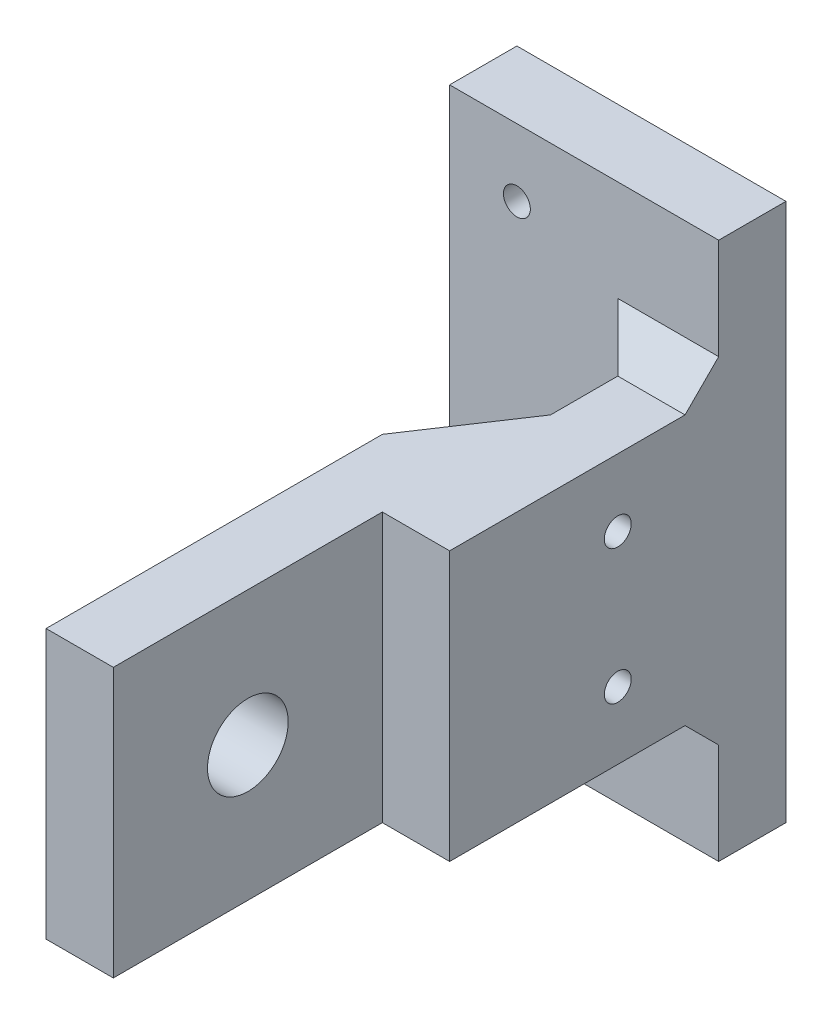
from build123d import *

# Parameters (mm, degrees)
SKETCH1_W                      = 80
SKETCH1_H                      = 80
BOSS_EXTRUDE1_DEPTH            = 10
SKETCH2_W                      = 40
SKETCH2_H                      = 40
BOSS_EXTRUDE2_DEPTH            = 80
F_4_0_4_DIAMETER_HOLE1_D       = 4
CUT_EXTRUDE1_REACH             = 117.326
CUT_EXTRUDE1_DIRECTION_2_REACH = 117.326
CUT_EXTRUDE2_REACH             = 117.326
SKETCH10_W                     = 10
SKETCH10_H                     = 30
BOSS_EXTRUDE3_DEPTH            = 3
F_12_0_MM_DOWEL_HOLES1_D       = 12
CHAMFER1_SIZE                  = 5


with BuildPart() as part:
    # Sketch1 → Boss-Extrude1 (new body)
    with BuildSketch(Plane(origin=(0, 0, 0), x_dir=(0, 1, 0), z_dir=(0, 0, 1))):
        Rectangle(SKETCH1_W, SKETCH1_H)
    extrude(amount=BOSS_EXTRUDE1_DEPTH)

    # Sketch2 → Boss-Extrude2 (add)
    with BuildSketch(Plane.XY.offset(10)):
        Rectangle(SKETCH2_W, SKETCH2_H)
    extrude(amount=BOSS_EXTRUDE2_DEPTH)

    # Ø4.0 (4) Diameter Hole1 (through all)
    with Locations(Plane.XY.offset(10)):
        with Locations((-30, -30), (30, -30)):
            f_4_0_4_diameter_hole1 = Hole(F_4_0_4_DIAMETER_HOLE1_D / 2)

    # Sketch9 → Cut-Extrude1 (cut, up to next)
    with BuildSketch(Plane.XZ.offset(20), mode=Mode.PRIVATE) as cut_extrude1_sk1:
        Polygon((-10, 90), (40, 90), (40, 45), (40, 0), (0, 0), (0, 50), (-10, 50), align=None)
    cut_extrude1_tool1 = extrude(cut_extrude1_sk1.sketch, amount=-CUT_EXTRUDE1_REACH, mode=Mode.PRIVATE) & part.part
    add(cut_extrude1_tool1.solids().sort_by_distance((17.5, -20, 47.5))[0], mode=Mode.SUBTRACT)

    # Sketch9 → Cut-Extrude1 direction 2 (cut, up to next)
    with BuildSketch(Plane.XZ.offset(20), mode=Mode.PRIVATE) as cut_extrude1_direction_2_sk1:
        Polygon((-10, 90), (40, 90), (40, 45), (40, 0), (0, 0), (0, 50), (-10, 50), align=None)
    cut_extrude1_direction_2_tool1 = extrude(cut_extrude1_direction_2_sk1.sketch, amount=CUT_EXTRUDE1_DIRECTION_2_REACH, mode=Mode.PRIVATE) & part.part
    add(cut_extrude1_direction_2_tool1.solids().sort_by_distance((17.5, -20, 47.5))[0], mode=Mode.SUBTRACT)

    # Sketch10 → Cut-Extrude2 (cut, up to next)
    with BuildSketch(Plane.XZ.offset(20), mode=Mode.PRIVATE) as cut_extrude2_sk1:
        with Locations((-15, 25)):
            Rectangle(SKETCH10_W, SKETCH10_H)
    cut_extrude2_tool1 = extrude(cut_extrude2_sk1.sketch, amount=-CUT_EXTRUDE2_REACH, mode=Mode.PRIVATE) & part.part
    add(cut_extrude2_tool1.solids().sort_by_distance((-15, -20, 25))[0], mode=Mode.SUBTRACT)

    # Sketch11 → Boss-Extrude3 (add)
    with BuildSketch(Plane.XZ.offset(20)):
        Polygon((-20, 40), (-10, 25), (-10, 40), align=None)
    boss_extrude3 = extrude(amount=-BOSS_EXTRUDE3_DEPTH)

    # Mirror2: Boss-Extrude3 across plane
    add(boss_extrude3.mirror(Plane.ZX))

    # Sketch13 → Ø4.0 (4) Diameter Hole2 (revolve, cut)
    with BuildSketch(Plane(origin=(-10, 10, 25), x_dir=(0, 0, 1), z_dir=(0, 1, 0))):
        Polygon((0, 0), (0, 11.301721238), (2, 10.1), (2, 0), align=None)
    f_4_0_4_diameter_hole2 = revolve(axis=Axis((-16.35, 10, 25), (1, 0, 0)), mode=Mode.SUBTRACT)

    # Ø12.0 mm Dowel Holes1 (through all)
    with Locations(Plane(origin=(-20, 0, 0), x_dir=(0, -1, 0), z_dir=(-1, 0, 0))):
        with Locations((0, 70)):
            Hole(F_12_0_MM_DOWEL_HOLES1_D / 2)

    # Chamfer1
    chamfer1_edges = [part.edges().sort_by_distance(p)[0] for p in [
        (-5, 20, 10),
        (-5, -20, 10),
        (-10, 0, 10),
    ]]
    chamfer(chamfer1_edges, length=CHAMFER1_SIZE)

    # Mirror3: Ø4.0 (4) Diameter Hole1, Ø4.0 (4) Diameter Hole2 across plane
    add(f_4_0_4_diameter_hole1.mirror(Plane.ZX), mode=Mode.SUBTRACT)
    add(f_4_0_4_diameter_hole2.mirror(Plane.ZX), mode=Mode.SUBTRACT)


solid = part.part
